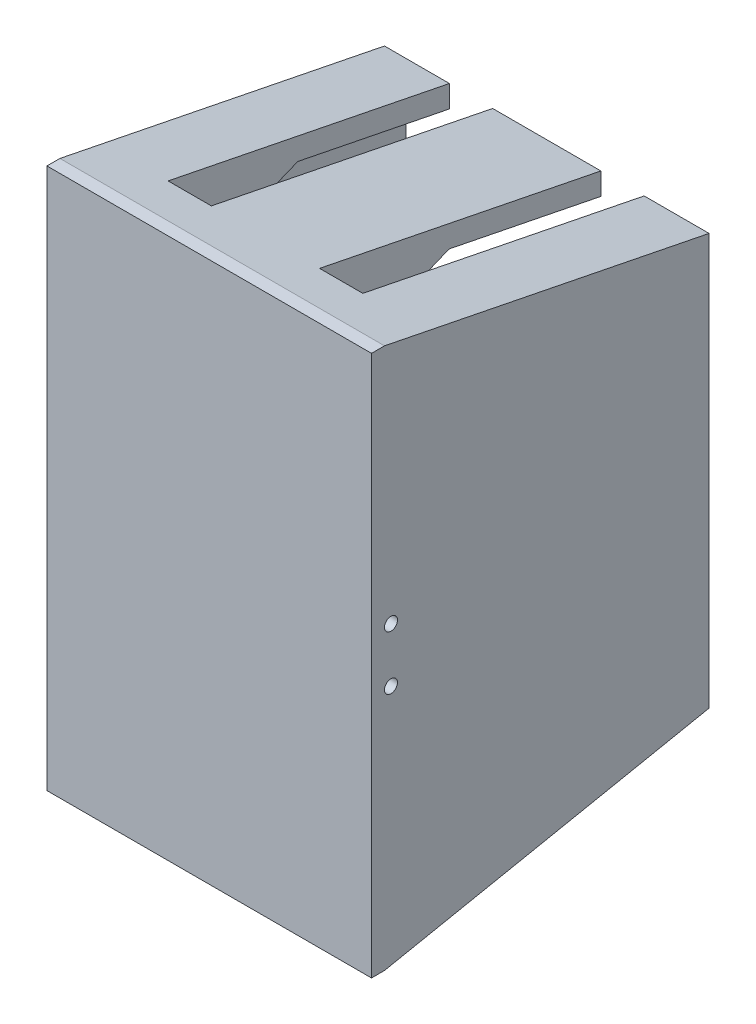
from build123d import *

# Parameters (mm, degrees)
BOSS_EXTRUDE1_DEPTH     = 37.5
SHELL1_T                = -5
BOSS_EXTRUDE4_DEPTH     = 65
CUT_EXTRUDE4_DEPTH      = 82.967981554
CUT_EXTRUDE4_DEPTH_BACK = 82.967981554
SKETCH11_W              = 10
SKETCH11_H              = 65
SKETCH13_W              = 75
SKETCH13_H              = 125
BOSS_EXTRUDE5_DEPTH     = 3
SKETCH12_R              = 1.5
CUT_EXTRUDE5_DEPTH      = 106.695316831


with BuildPart() as part:
    # Sketch1 → Boss-Extrude1 (new, symmetric)
    with BuildSketch(Plane(origin=(0, 0, 0), x_dir=(0, 0, -1), z_dir=(1, 0, 0))):
        Polygon((-37.5, 32.5), (-37.5, -52.5), (-37.5, -62.5), (37.5, -47.5), (37.5, -37.5), (37.5, -32.5), (37.5, 32.5), (37.5, 47.5), (-37.5, 62.5), (-37.5, 47.5), align=None)
    extrude(amount=BOSS_EXTRUDE1_DEPTH, both=True)

    # Shell1
    shell1_openings = [part.faces().sort_by_distance(p)[0] for p in [
        (0, 0, -37.5),
    ]]
    offset(amount=SHELL1_T, openings=shell1_openings, kind=Kind.INTERSECTION)

    # Sketch10 → Boss-Extrude4 (add)
    with BuildSketch(Plane.ZY.offset(-32.5)):
        with BuildLine():
            Line((-2.5, -49.400980486), (32.5, -56.400980486))
            Line((32.5, -56.400980486), (32.5, 0))
            ThreePointArc((32.5, 0), (22.863250205, -30.271508358), (-2.5, -49.400980486))
        make_face()
        with BuildLine():
            ThreePointArc((-2.5, 49.400980486), (22.863250205, 30.271508358), (32.5, 0))
            Line((32.5, 0), (32.5, 56.400980486))
            Line((32.5, 56.400980486), (-2.5, 49.400980486))
        make_face()
    extrude(amount=BOSS_EXTRUDE4_DEPTH)

    # Sketch11 → Cut-Extrude4 (cut, two sides: drawn at the far end of the back side and taken through both)
    with BuildSketch(Plane(origin=(0, 0, 0), x_dir=(1, 0, 0), z_dir=(0, 1, 0)).offset(-CUT_EXTRUDE4_DEPTH_BACK)):
        with Locations((-17.5, 5)):
            Rectangle(SKETCH11_W, SKETCH11_H)
        with Locations((17.5, 5)):
            Rectangle(SKETCH11_W, SKETCH11_H)
    extrude(amount=CUT_EXTRUDE4_DEPTH + CUT_EXTRUDE4_DEPTH_BACK, mode=Mode.SUBTRACT)

    # Sketch13 → Boss-Extrude5 (add)
    with BuildSketch(Plane.XY.offset(37.5)):
        Rectangle(SKETCH13_W, SKETCH13_H)
    extrude(amount=BOSS_EXTRUDE5_DEPTH)

    # Sketch12 → Cut-Extrude5 (cut, through all)
    with BuildSketch(Plane(origin=(37.5, 0, 0), x_dir=(0, 0, -1), z_dir=(1, 0, 0))):
        with Locations((-36, 6.15)):
            Circle(SKETCH12_R)
        with Locations(Location((-36, -6.35, 0), (0, 0, 180))):
            Circle(SKETCH12_R)
    extrude(amount=-CUT_EXTRUDE5_DEPTH, mode=Mode.SUBTRACT)


solid = part.part
